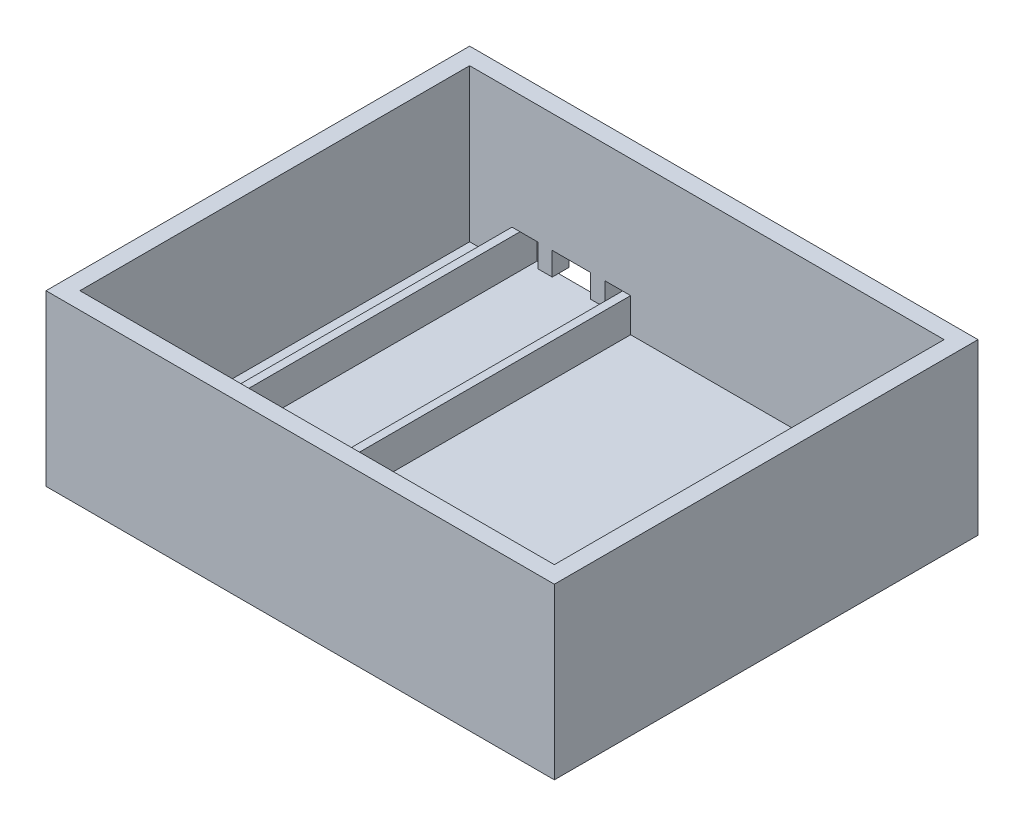
from build123d import *

# Parameters (mm, degrees)
SKETCH1_W           = 120
SKETCH1_H           = 100
BOSS_EXTRUDE1_DEPTH = 40
SKETCH2_W           = 112
SKETCH2_H           = 92
CUT_EXTRUDE1_DEPTH  = 36
SKETCH3_W           = 28
SKETCH3_H           = 70
BOSS_EXTRUDE3_DEPTH = 8
SKETCH6_W           = 24.21
SKETCH6_H           = 8
CUT_EXTRUDE4_DEPTH  = 66
CUT_EXTRUDE6_DEPTH  = 66


with BuildPart() as part:
    # Sketch1 → Boss-Extrude1 (new body)
    with BuildSketch(Plane(origin=(0, 0, 0), x_dir=(1, 0, 0), z_dir=(0, 1, 0))):
        with Locations((-10.571222942, 10.082692781)):
            Rectangle(SKETCH1_W, SKETCH1_H)
    extrude(amount=BOSS_EXTRUDE1_DEPTH)

    # Sketch2 → Cut-Extrude1 (cut)
    with BuildSketch(Plane(origin=(0, 40, 0), x_dir=(1, 0, 0), z_dir=(0, 1, 0))):
        with Locations((-10.571222942, 10.082692781)):
            Rectangle(SKETCH2_W, SKETCH2_H)
    extrude(amount=-CUT_EXTRUDE1_DEPTH, mode=Mode.SUBTRACT)

    # Sketch3 → Boss-Extrude3 (add)
    with BuildSketch(Plane(origin=(0, 4, 0), x_dir=(1, 0, 0), z_dir=(0, 1, 0))):
        with Locations((-42.571222942, 25.082692781)):
            Rectangle(SKETCH3_W, SKETCH3_H)
    extrude(amount=BOSS_EXTRUDE3_DEPTH)

    # Sketch6 → Cut-Extrude4 (cut)
    with BuildSketch(Plane.XY.offset(9.917307219)):
        with Locations((-42.569304131, 8)):
            Rectangle(SKETCH6_W, SKETCH6_H)
    extrude(amount=-CUT_EXTRUDE4_DEPTH, mode=Mode.SUBTRACT)

    # Sketch7 → Cut-Extrude6 (cut)
    with BuildSketch(Plane.XY.offset(-56.082692781)):
        Polygon((-54.674304131, 12), (-50.474304131, 12), (-50.474304131, 6.53), (-47.074304131, 6.53), (-47.074304131, 12), (-38.074304131, 12), (-38.074304131, 6.53), (-34.664304131, 6.53), (-34.664304131, 12), (-30.464304131, 12), (-30.464304131, 6.53), (-30.464304131, 4), (-54.674304131, 4), (-54.674304131, 6.53), align=None)
    extrude(amount=-CUT_EXTRUDE6_DEPTH, mode=Mode.SUBTRACT)


solid = part.part
